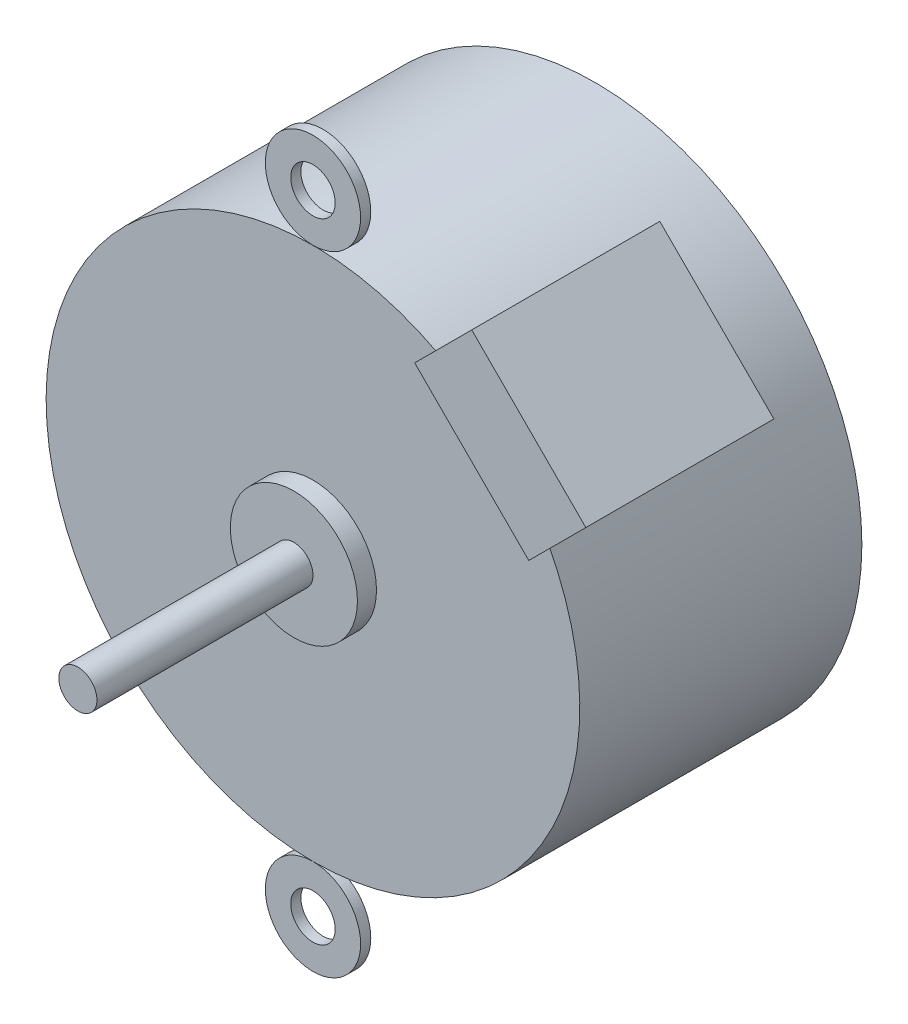
from build123d import *

# Parameters (mm, degrees)
SKETCH1_R           = 21
BOSS_EXTRUDE1_DEPTH = 0.8
SKETCH2_R           = 3.75
BOSS_EXTRUDE2_DEPTH = 0.8
SKETCH3_R           = 3.75
BOSS_EXTRUDE3_DEPTH = 0.8
SKETCH4_R           = 1.75
CUT_EXTRUDE2_DEPTH  = 1.8
BOSS_EXTRUDE4_START = -21.4
SKETCH5_R           = 21
BOSS_EXTRUDE4_DEPTH = 21.4
SKETCH6_R           = 4
BOSS_EXTRUDE5_DEPTH = 22.4
SKETCH7_R           = 5
BOSS_EXTRUDE6_DEPTH = 2.3
SKETCH8_R           = 1.5
BOSS_EXTRUDE7_DEPTH = 19.3
BOSS_EXTRUDE8_DEPTH = 12
BOSS_EXTRUDE9_DEPTH = 2.8


with BuildPart() as part:
    # Sketch1 → Boss-Extrude1 (new body)
    with BuildSketch(Plane.XY):
        Circle(SKETCH1_R)
    extrude(amount=BOSS_EXTRUDE1_DEPTH)

    # Sketch5 → Boss-Extrude4 (add)
    with BuildSketch(Plane.XY.offset(BOSS_EXTRUDE4_START)):
        Circle(SKETCH5_R)
    extrude(amount=BOSS_EXTRUDE4_DEPTH)

    # Sketch6 → Boss-Extrude5 (add)
    with BuildSketch(Plane.XY):
        Circle(SKETCH6_R)
    extrude(amount=-BOSS_EXTRUDE5_DEPTH)

    # Sketch7 → Boss-Extrude6 (add)
    with BuildSketch(Plane.XY):
        Circle(SKETCH7_R)
    extrude(amount=BOSS_EXTRUDE6_DEPTH)

    # Sketch8 → Boss-Extrude7 (add)
    with BuildSketch(Plane.XY):
        Circle(SKETCH8_R)
    extrude(amount=BOSS_EXTRUDE7_DEPTH)

    # Sketch9 → Boss-Extrude8 (add)
    with BuildSketch(Plane.XY):
        Polygon((18.985817075, 10.005560954), (10.005560954, 18.985817075), (14.495689014, 23.475945135), (23.475945135, 14.495689014), align=None)
    extrude(amount=-BOSS_EXTRUDE8_DEPTH)

    # Sketch10 → Boss-Extrude9 (add)
    with BuildSketch(Plane.XY):
        Polygon((18.985817075, 10.005560954), (10.005560954, 18.985817075), (14.495689014, 23.475945135), (23.475945135, 14.495689014), align=None)
    extrude(amount=BOSS_EXTRUDE9_DEPTH)


with BuildPart() as body_2:
    # Sketch2 → Boss-Extrude2 (new body)
    with BuildSketch(Plane.XY):
        with Locations((0, 24.75)):
            Circle(SKETCH2_R)
    extrude(amount=BOSS_EXTRUDE2_DEPTH)


with BuildPart() as body_3:
    # Sketch3 → Boss-Extrude3 (new body)
    with BuildSketch(Plane.XY):
        with Locations((0, -24.75)):
            Circle(SKETCH3_R)
    extrude(amount=BOSS_EXTRUDE3_DEPTH)


with BuildPart() as cut_extrude2_tool:
    # Sketch4 → Cut-Extrude2 (new body)
    with BuildSketch(Plane.XY):
        with Locations((0, 24.75)):
            Circle(SKETCH4_R)
        with Locations((0, -24.75)):
            Circle(SKETCH4_R)
    extrude(amount=CUT_EXTRUDE2_DEPTH)


with BuildPart() as body_2_1:
    add(body_2.part)

    # Cut-Extrude2: cut by cut_extrude2_tool
    add(cut_extrude2_tool.part, mode=Mode.SUBTRACT)


with BuildPart() as body_3_1:
    add(body_3.part)

    # Cut-Extrude2: cut by cut_extrude2_tool
    add(cut_extrude2_tool.part, mode=Mode.SUBTRACT)


solid = Compound([part.part, body_2_1.part, body_3_1.part])
